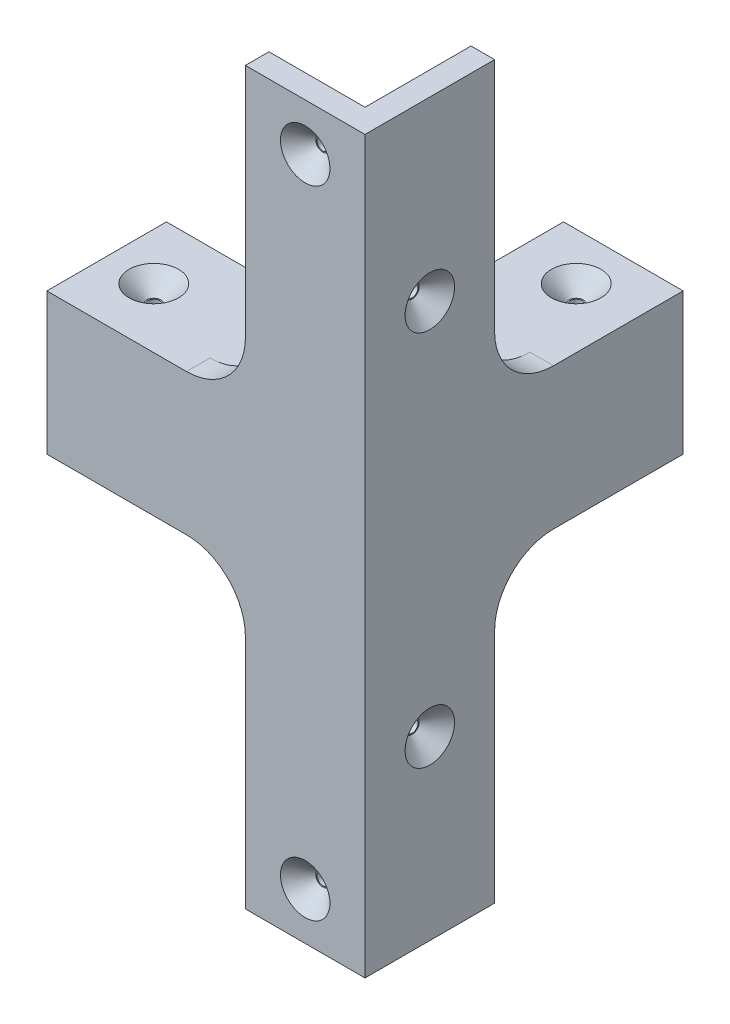
from build123d import *

# Parameters (mm, degrees)
SKETCH1_W                    = 33.7
SKETCH1_H                    = 20.3
SKETCH1_W_2                  = 20.3
SKETCH1_H_2                  = 33.7
BOSS_EXTRUDE1_DEPTH          = 24
SHELL1_T                     = -4
SKETCH2_R                    = 1
CUT_EXTRUDE1_DEPTH           = 24
SKETCH3_R                    = 4.2
CUT_EXTRUDE2_DEPTH           = 3
CUT_EXTRUDE2_DRAFT           = -45
CUT_EXTRUDE2_PROFILE_2_DEPTH = 3
CUT_EXTRUDE2_PROFILE_2_DRAFT = -45
SKETCH4_W                    = 20.3
SKETCH4_H                    = 22
BOSS_EXTRUDE2_DEPTH          = 50
SHELL2_T                     = -4
CUT_EXTRUDE3_REACH           = 93.28
SKETCH5_R                    = 1
SKETCH6_R                    = 4.2
CUT_EXTRUDE4_DEPTH           = 3
CUT_EXTRUDE4_DRAFT           = -45
CUT_EXTRUDE5_REACH           = 93.28
SKETCH7_R                    = 1
SKETCH8_R                    = 4.2
CUT_EXTRUDE6_DEPTH           = 3
CUT_EXTRUDE6_DRAFT           = -45
FILLET1_R                    = 10
BOSS_EXTRUDE3_DEPTH          = 50
MIRROR4_COPY_1_SKETCH_R      = 4.2
MIRROR4_COPY_1_DEPTH         = 3
MIRROR4_COPY_1_DRAFT         = -45
MIRROR4_COPY_2_SKETCH_R      = 4.2
MIRROR4_COPY_2_DEPTH         = 3
MIRROR4_COPY_2_DRAFT         = -45
FILLET2_R                    = 10


with BuildPart() as part:
    # Sketch1 → Boss-Extrude1 (new body)
    with BuildSketch(Plane(origin=(0, 0, 0), x_dir=(1, 0, 0), z_dir=(0, 1, 0))):
        with Locations((-37.15, 10.15)):
            Rectangle(SKETCH1_W, SKETCH1_H)
        with Locations((-10.15, 10.15)):
            Rectangle(SKETCH1_W_2, SKETCH1_H)
        with Locations((-10.15, 37.15)):
            Rectangle(SKETCH1_W_2, SKETCH1_H_2)
    extrude(amount=-BOSS_EXTRUDE1_DEPTH)

    # Shell1
    shell1_openings = [part.faces().sort_by_distance(p)[0] for p in [
        (-53.236324676, -24, -10.15),
        (-54, -12, -10.15),
        (-37.15, -12, -20.3),
        (-20.3, -12, -37.15),
        (-10.15, -12, -54),
    ]]
    offset(amount=SHELL1_T, openings=shell1_openings, kind=Kind.INTERSECTION)

    # Sketch2 → Cut-Extrude1 (cut)
    with BuildSketch(Plane(origin=(0, 0, 0), x_dir=(1, 0, 0), z_dir=(0, 1, 0))):
        with Locations(Location((-10.15, 46, 0), (0, 0, 270))):
            Circle(SKETCH2_R)
        with Locations(Location((-46, 10.15, 0), (0, 0, 270))):
            Circle(SKETCH2_R)
    extrude(amount=-CUT_EXTRUDE1_DEPTH, mode=Mode.SUBTRACT)


with BuildPart() as cut_extrude2_tool:
    # Sketch3 → Cut-Extrude2 (with draft: the straight prism first)
    with BuildSketch(Plane(origin=(0, 0, 0), x_dir=(1, 0, 0), z_dir=(0, 1, 0))):
        with Locations((-46, 10.15)):
            Circle(SKETCH3_R)
    extrude(amount=-CUT_EXTRUDE2_DEPTH)
    # Cut-Extrude2: the draft: its side faces are tilted about the plane it starts from
    cut_extrude2_sides = [cut_extrude2_tool.faces().sort_by_distance(p)[0] for p in [
        (-50.2, -1.5, -10.15),
    ]]
    draft(cut_extrude2_sides, Plane(origin=(0, 0, 0), x_dir=(1, 0, 0), z_dir=(0, 1, 0)), CUT_EXTRUDE2_DRAFT)


with BuildPart() as part_1:
    add(part.part)

    # Cut-Extrude2: cut by cut_extrude2_tool
    add(cut_extrude2_tool.part, mode=Mode.SUBTRACT)


with BuildPart() as cut_extrude2_profile_2_tool:
    # Sketch3 → Cut-Extrude2 profile 2 (with draft: the straight prism first)
    with BuildSketch(Plane(origin=(0, 0, 0), x_dir=(1, 0, 0), z_dir=(0, 1, 0))):
        with Locations((-10.15, 46)):
            Circle(SKETCH3_R)
    extrude(amount=-CUT_EXTRUDE2_PROFILE_2_DEPTH)
    # Cut-Extrude2 profile 2: the draft: its side faces are tilted about the plane it starts from
    cut_extrude2_profile_2_sides = [cut_extrude2_profile_2_tool.faces().sort_by_distance(p)[0] for p in [
        (-14.35, -1.5, -46),
    ]]
    draft(cut_extrude2_profile_2_sides, Plane(origin=(0, 0, 0), x_dir=(1, 0, 0), z_dir=(0, 1, 0)), CUT_EXTRUDE2_PROFILE_2_DRAFT)


with BuildPart() as part_2:
    add(part_1.part)

    # Cut-Extrude2 profile 2: cut by cut_extrude2_profile_2_tool
    add(cut_extrude2_profile_2_tool.part, mode=Mode.SUBTRACT)


with BuildPart() as body_2:
    # Sketch4 → Boss-Extrude2 (new body)
    with BuildSketch(Plane(origin=(0, 0, 0), x_dir=(1, 0, 0), z_dir=(0, 1, 0))):
        with Locations((-10.15, 11)):
            Rectangle(SKETCH4_W, SKETCH4_H)
    extrude(amount=BOSS_EXTRUDE2_DEPTH)

    # Shell2
    shell2_openings = [body_2.faces().sort_by_distance(p)[0] for p in [
        (-10.15, 50, -11),
        (-10.15, 0, -11),
        (-20.3, 25, -11),
        (-10.15, 25, -22),
    ]]
    offset(amount=SHELL2_T, openings=shell2_openings, kind=Kind.INTERSECTION)


with BuildPart() as part_3:
    add(part_2.part)

    # Combine1: union body 2
    add(body_2.part)

    # Sketch5 → Cut-Extrude3 (cut, up to next)
    with BuildSketch(Plane.XY, mode=Mode.PRIVATE) as cut_extrude3_sk1:
        with Locations((-10.15, 42)):
            Circle(SKETCH5_R)
    cut_extrude3_tool1 = extrude(cut_extrude3_sk1.sketch, amount=-CUT_EXTRUDE3_REACH, mode=Mode.PRIVATE) & part_3.part
    cut_extrude3 = cut_extrude3_tool1.solids().sort_by_distance((-10.15, 42, 0))[0]
    add(cut_extrude3, mode=Mode.SUBTRACT)


with BuildPart() as cut_extrude4_tool:
    # Sketch6 → Cut-Extrude4 (with draft: the straight prism first)
    with BuildSketch(Plane.XY):
        with Locations((-10.15, 42)):
            Circle(SKETCH6_R)
    extrude(amount=-CUT_EXTRUDE4_DEPTH)
    # Cut-Extrude4: the draft: its side faces are tilted about the plane it starts from
    cut_extrude4_sides = [cut_extrude4_tool.faces().sort_by_distance(p)[0] for p in [
        (-14.35, 42, -1.5),
    ]]
    draft(cut_extrude4_sides, Plane.XY, CUT_EXTRUDE4_DRAFT)


with BuildPart() as part_4:
    add(part_3.part)

    # Cut-Extrude4: cut by cut_extrude4_tool
    add(cut_extrude4_tool.part, mode=Mode.SUBTRACT)

    # Sketch7 → Cut-Extrude5 (cut, up to next)
    with BuildSketch(Plane(origin=(0, 0, 0), x_dir=(0, 0, -1), z_dir=(1, 0, 0)), mode=Mode.PRIVATE) as cut_extrude5_sk1:
        with Locations((11, 20)):
            Circle(SKETCH7_R)
    cut_extrude5_tool1 = extrude(cut_extrude5_sk1.sketch, amount=-CUT_EXTRUDE5_REACH, mode=Mode.PRIVATE) & part_4.part
    cut_extrude5 = cut_extrude5_tool1.solids().sort_by_distance((0, 20, -11))[0]
    add(cut_extrude5, mode=Mode.SUBTRACT)


with BuildPart() as cut_extrude6_tool:
    # Sketch8 → Cut-Extrude6 (with draft: the straight prism first)
    with BuildSketch(Plane(origin=(0, 0, 0), x_dir=(0, 0, -1), z_dir=(1, 0, 0))):
        with Locations((11, 20)):
            Circle(SKETCH8_R)
    extrude(amount=-CUT_EXTRUDE6_DEPTH)
    # Cut-Extrude6: the draft: its side faces are tilted about the plane it starts from
    cut_extrude6_sides = [cut_extrude6_tool.faces().sort_by_distance(p)[0] for p in [
        (-1.5, 20, -6.8),
    ]]
    draft(cut_extrude6_sides, Plane(origin=(0, 0, 0), x_dir=(0, 0, -1), z_dir=(1, 0, 0)), CUT_EXTRUDE6_DRAFT)


with BuildPart() as part_5:
    add(part_4.part)

    # Cut-Extrude6: cut by cut_extrude6_tool
    add(cut_extrude6_tool.part, mode=Mode.SUBTRACT)

    # Fillet1
    fillet1_edges = [part_5.edges().sort_by_distance(p)[0] for p in [
        (-2, 0, -22),
        (-20.3, 0, -2),
    ]]
    fillet(fillet1_edges, radius=FILLET1_R)

    # Sketch9 → Boss-Extrude3 (add)
    with BuildSketch(Plane.XZ.offset(24)):
        Polygon((-4, -4), (-4, -22), (0, -22), (0, 0), (-20.3, 0), (-20.3, -4), align=None)
    extrude(amount=BOSS_EXTRUDE3_DEPTH)

    # Mirror4: Cut-Extrude3, Cut-Extrude5 across plane
    add(cut_extrude3.mirror(Plane(origin=(0, -12, 0), x_dir=(0, 0, 1), z_dir=(0, -1, 0))), mode=Mode.SUBTRACT)
    add(cut_extrude5.mirror(Plane(origin=(0, -12, 0), x_dir=(0, 0, 1), z_dir=(0, -1, 0))), mode=Mode.SUBTRACT)


with BuildPart() as mirror4_copy_1_tool:
    # Mirror4 copy 1 sketch → Mirror4 copy 1 (with draft: the straight prism first)
    with BuildSketch(Plane(origin=(0, -24, 0), x_dir=(1, 0, 0), z_dir=(0, 0, 1))):
        with Locations((-10.15, -42)):
            Circle(MIRROR4_COPY_1_SKETCH_R)
    extrude(amount=-MIRROR4_COPY_1_DEPTH)
    # Mirror4 copy 1: the draft: its side faces are tilted about the plane it starts from
    mirror4_copy_1_sides = [mirror4_copy_1_tool.faces().sort_by_distance(p)[0] for p in [
        (-14.35, -66, -1.5),
    ]]
    draft(mirror4_copy_1_sides, Plane(origin=(0, -24, 0), x_dir=(1, 0, 0), z_dir=(0, 0, 1)), MIRROR4_COPY_1_DRAFT)


with BuildPart() as part_6:
    add(part_5.part)

    # Mirror4 copy 1: cut by mirror4_copy_1_tool
    add(mirror4_copy_1_tool.part, mode=Mode.SUBTRACT)


with BuildPart() as mirror4_copy_2_tool:
    # Mirror4 copy 2 sketch → Mirror4 copy 2 (with draft: the straight prism first)
    with BuildSketch(Plane(origin=(0, -24, 0), x_dir=(0, 0, -1), z_dir=(1, 0, 0))):
        with Locations((11, -20)):
            Circle(MIRROR4_COPY_2_SKETCH_R)
    extrude(amount=-MIRROR4_COPY_2_DEPTH)
    # Mirror4 copy 2: the draft: its side faces are tilted about the plane it starts from
    mirror4_copy_2_sides = [mirror4_copy_2_tool.faces().sort_by_distance(p)[0] for p in [
        (-1.5, -44, -6.8),
    ]]
    draft(mirror4_copy_2_sides, Plane(origin=(0, -24, 0), x_dir=(0, 0, -1), z_dir=(1, 0, 0)), MIRROR4_COPY_2_DRAFT)


with BuildPart() as part_7:
    add(part_6.part)

    # Mirror4 copy 2: cut by mirror4_copy_2_tool
    add(mirror4_copy_2_tool.part, mode=Mode.SUBTRACT)

    # Fillet2
    fillet2_edges = [part_7.edges().sort_by_distance(p)[0] for p in [
        (-2, -24, -22),
        (-20.3, -24, -2),
    ]]
    fillet(fillet2_edges, radius=FILLET2_R)


solid = part_7.part
